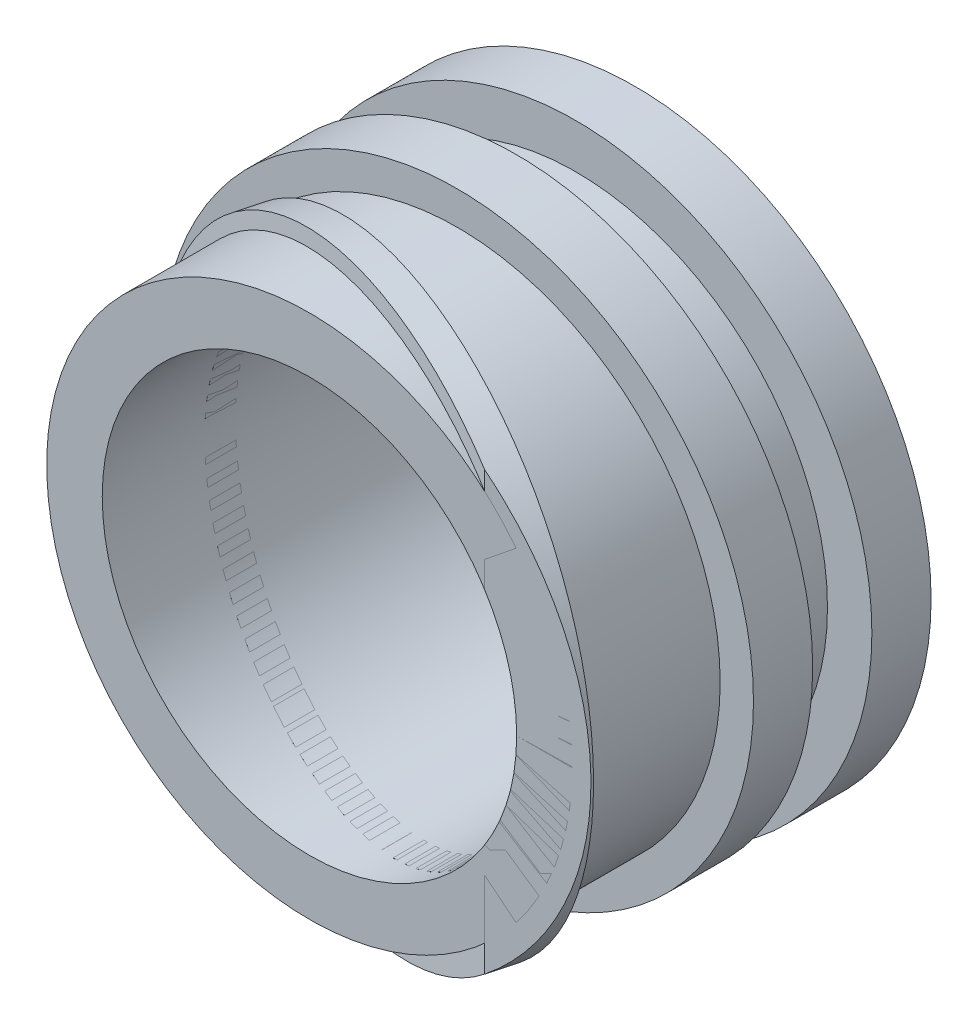
from build123d import *

# Parameters (mm, degrees)
SKETCH1_R           = 10
BOSS_EXTRUDE1_DEPTH = 2
SKETCH2_R           = 8.5
BOSS_EXTRUDE2_DEPTH = 6
BOSS_EXTRUDE3_START = 4
SKETCH3_R           = 10
BOSS_EXTRUDE3_DEPTH = 2
SKETCH5_R           = 7
CUT_EXTRUDE2_DEPTH  = 16.362291496
BOSS_EXTRUDE4_START = 6
SKETCH6_R           = 8.875
SKETCH6_R_2         = 7
BOSS_EXTRUDE4_DEPTH = 5
SKETCH8_R           = 9.583059544
BOSS_EXTRUDE5_DEPTH = 1
SKETCH10_R          = 7
CUT_EXTRUDE4_DEPTH  = 19.480929695
SKETCH12_W          = 0.915114883
SKETCH12_H          = 17.75
CUT_EXTRUDE5_DEPTH  = 10


with BuildPart() as part:
    # Sketch1 → Boss-Extrude1 (new body)
    with BuildSketch(Plane.XY):
        Circle(SKETCH1_R)
    extrude(amount=BOSS_EXTRUDE1_DEPTH)

    # Sketch2 → Boss-Extrude2 (add)
    with BuildSketch(Plane.XY):
        Circle(SKETCH2_R)
    extrude(amount=BOSS_EXTRUDE2_DEPTH)

    # Sketch3 → Boss-Extrude3 (add)
    with BuildSketch(Plane.XY.offset(BOSS_EXTRUDE3_START)):
        Circle(SKETCH3_R)
    extrude(amount=BOSS_EXTRUDE3_DEPTH)

    # Sketch5 → Cut-Extrude2 (cut, through all)
    with BuildSketch(Plane.XY):
        Circle(SKETCH5_R)
    extrude(amount=CUT_EXTRUDE2_DEPTH, mode=Mode.SUBTRACT)

    # Sketch6 → Boss-Extrude4 (add)
    with BuildSketch(Plane.XY.offset(BOSS_EXTRUDE4_START)):
        Circle(SKETCH6_R)
        Circle(SKETCH6_R_2, mode=Mode.SUBTRACT)
    extrude(amount=BOSS_EXTRUDE4_DEPTH)


with BuildPart() as body_2:
    # Sketch8 → Boss-Extrude5 (new body)
    with BuildSketch(Plane(origin=(-2.094512271, 0, 7.816826211), x_dir=(0.9659258262890681, 0, 0.25881904510252135), z_dir=(-0.25881904510252135, 0, 0.9659258262890681))):
        with Locations((2.450469787, -0.133986717)):
            Circle(SKETCH8_R)
    extrude(amount=BOSS_EXTRUDE5_DEPTH)

    # Sketch10 → Cut-Extrude4 (cut, through all)
    with BuildSketch(Plane.XY):
        with Locations(Location((0, 0, 0), (0, 0, 180))):
            Circle(SKETCH10_R)
    extrude(amount=CUT_EXTRUDE4_DEPTH, mode=Mode.SUBTRACT)

    # Sketch12 → Cut-Extrude5 (cut)
    with BuildSketch(Plane(origin=(0, 0, 0), x_dir=(0, 0, -1), z_dir=(1, 0, 0))):
        with Locations((-11.457557442, 0)):
            Rectangle(SKETCH12_W, SKETCH12_H)
    extrude(amount=CUT_EXTRUDE5_DEPTH, mode=Mode.SUBTRACT)


solid = Compound([part.part, body_2.part])
